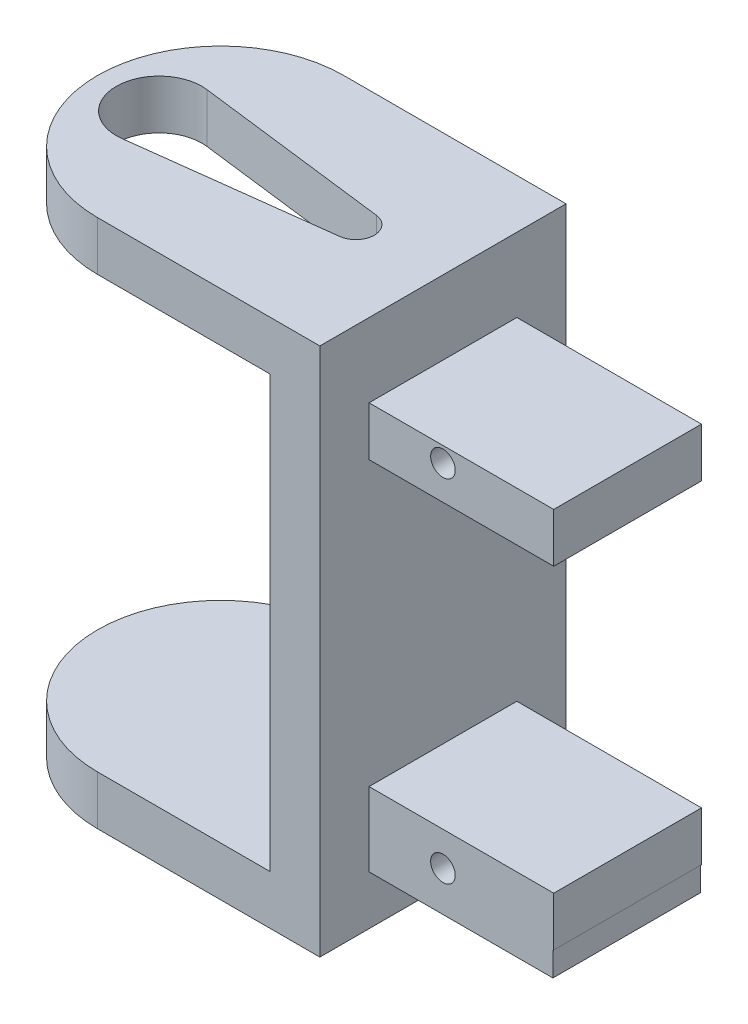
from build123d import *

# Parameters (mm, degrees)
EXTRUDE_1_DEPTH     = 20
CUT_EXTRUDE_2_DEPTH = 20
SKETCH_6_W          = 20
SKETCH_6_H          = 46
EXTRUDE_2_DEPTH     = 3
SKETCH_7_W          = 4
SKETCH_7_H          = 38
CUT_EXTRUDE_4_DEPTH = 23
SKETCH_8_W          = 27.047351985
SKETCH_8_H          = 20
EXTRUDE_3_DEPTH     = 3
SKETCH_9_W          = 28.062086438
SKETCH_9_H          = 3
CUT_EXTRUDE_5_DEPTH = 50
CUT_EXTRUDE_6_DEPTH = 50
SKETCH_11_W         = 6.001651559
SKETCH_11_H         = 4
EXTRUDE_4_DEPTH     = 15
SKETCH_16_W         = 14.934651965
SKETCH_16_H         = 12.003303118
EXTRUDE_5_DEPTH     = 2
SKETCH_21_R         = 1
CUT_EXTRUDE_8_DEPTH = 10


with BuildPart() as part:
    # 草图1 → 凸台-拉伸1 (new body)
    with BuildSketch(Plane.XY):
        Polygon((25.062086438, -46), (25.062086438, 0), (0, 0), (0, -4), (20, -4), (20, -42), (0, -42), (0, -46), align=None)
    extrude(amount=EXTRUDE_1_DEPTH)

    # 草图3 → 切除-拉伸2 (cut)
    with BuildSketch(Plane(origin=(0, 0, 0), x_dir=(1, 0, 0), z_dir=(0, 1, 0))):
        with BuildLine():
            Line((5.429347826, -13.448374319), (21.170329997, -11.4885069))
            ThreePointArc((21.170329997, -11.4885069), (22.485, -10), (21.170329997, -8.5114931))
            Line((21.170329997, -8.5114931), (5.429347826, -6.551625681))
            ThreePointArc((5.429347826, -6.551625681), (1.525, -10), (5.429347826, -13.448374319))
        make_face()
    extrude(amount=-CUT_EXTRUDE_2_DEPTH, mode=Mode.SUBTRACT)

    # 草图6 → 凸台-拉伸2 (add)
    with BuildSketch(Plane(origin=(25.062086438, 0, 0), x_dir=(0, 0, -1), z_dir=(1, 0, 0))):
        with Locations((-10, -23)):
            Rectangle(SKETCH_6_W, SKETCH_6_H)
    extrude(amount=EXTRUDE_2_DEPTH)

    # 草图7 → 切除-拉伸4 (cut)
    with BuildSketch(Plane.XY.offset(20)):
        with Locations((22, -23)):
            Rectangle(SKETCH_7_W, SKETCH_7_H)
    extrude(amount=-CUT_EXTRUDE_4_DEPTH, mode=Mode.SUBTRACT)

    # 草图8 → 凸台-拉伸3 (add)
    with BuildSketch(Plane(origin=(0, -42, 0), x_dir=(1, 0, 0), z_dir=(0, 1, 0))):
        with Locations((13.523675993, -10)):
            Rectangle(SKETCH_8_W, SKETCH_8_H)
    extrude(amount=EXTRUDE_3_DEPTH)

    # 草图9 → 切除-拉伸5 (cut)
    with BuildSketch(Plane.XY.offset(20)):
        with Locations((14.031043219, -44.5)):
            Rectangle(SKETCH_9_W, SKETCH_9_H)
    extrude(amount=-CUT_EXTRUDE_5_DEPTH, mode=Mode.SUBTRACT)

    # 草图10 → 切除-拉伸6 (cut)
    with BuildSketch(Plane(origin=(0, 0, 0), x_dir=(1, 0, 0), z_dir=(0, 1, 0))):
        with BuildLine():
            Line((10, 0), (0, 0))
            Line((0, 0), (0, -10))
            ThreePointArc((0, -10), (2.928932188, -2.928932188), (10, 0))
        make_face()
        with BuildLine():
            ThreePointArc((10, -20), (2.928932188, -17.071067812), (0, -10))
            Line((0, -10), (0, -20))
            Line((0, -20), (10, -20))
        make_face()
    extrude(amount=-CUT_EXTRUDE_6_DEPTH, mode=Mode.SUBTRACT)

    # 草图11 → 凸台-拉伸4 (add)
    with BuildSketch(Plane(origin=(28.062086438, 0, 0), x_dir=(0, 0, -1), z_dir=(1, 0, 0))):
        with Locations((-13.00082578, -8)):
            Rectangle(SKETCH_11_W, SKETCH_11_H)
        with Locations((-6.999174221, -8)):
            Rectangle(SKETCH_11_W, SKETCH_11_H)
        with Locations((-6.999174221, -35)):
            Rectangle(SKETCH_11_W, SKETCH_11_H)
        with Locations((-13.00082578, -35)):
            Rectangle(SKETCH_11_W, SKETCH_11_H)
    extrude(amount=EXTRUDE_4_DEPTH)

    # 草图16 → 凸台-拉伸5 (add)
    with BuildSketch(Plane.XZ.offset(37)):
        with Locations((35.529412421, 10)):
            Rectangle(SKETCH_16_W, SKETCH_16_H)
    extrude(amount=EXTRUDE_5_DEPTH)

    # 草图21 → 切除-拉伸8 (cut)
    with BuildSketch(Plane.XY.offset(16.001651559)):
        with Locations((34.062086438, -7.25)):
            Circle(SKETCH_21_R)
        with Locations((34.062086438, -35.75)):
            Circle(SKETCH_21_R)
    extrude(amount=-CUT_EXTRUDE_8_DEPTH, mode=Mode.SUBTRACT)


solid = part.part
